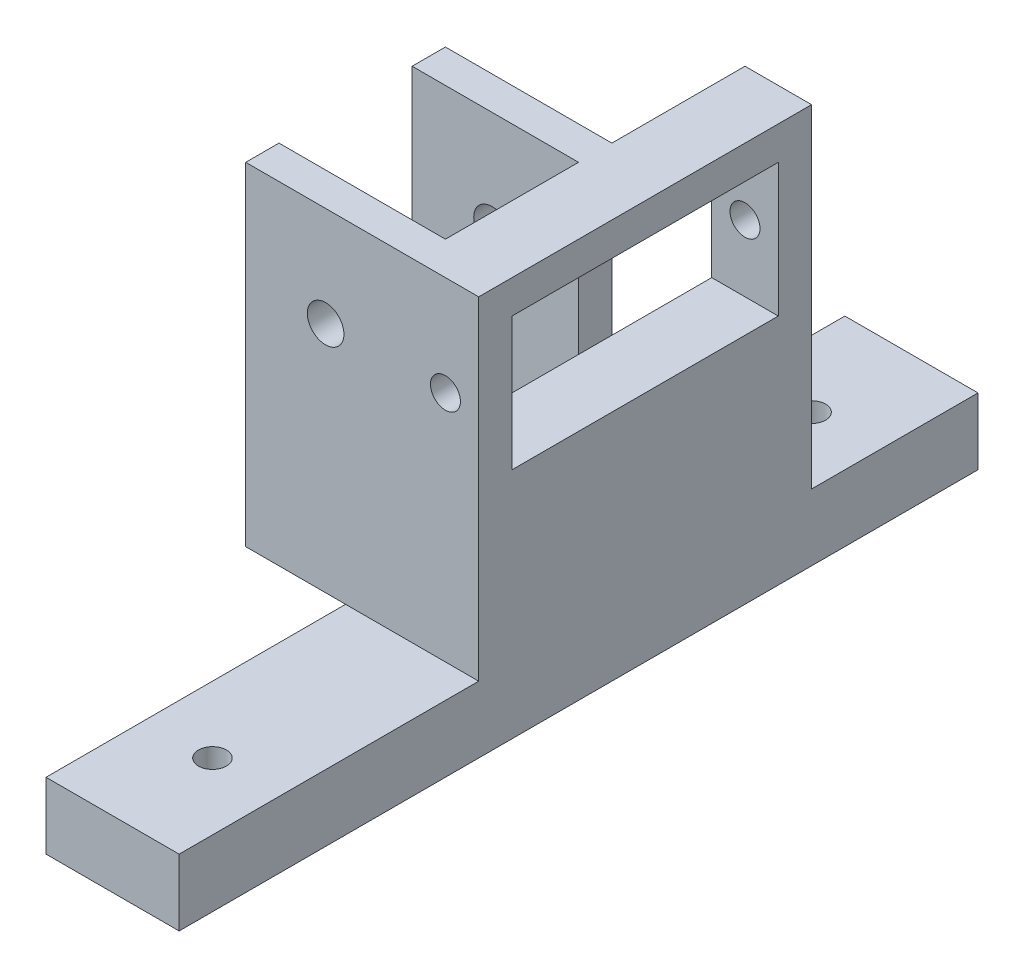
from build123d import *

# Parameters (mm, degrees)
SKETCH4_W            = 40
SKETCH4_H            = 80
BOSS_EXTRUDE4_DEPTH  = 5
SKETCH5_W            = 10
SKETCH5_H            = 5
BOSS_EXTRUDE6_DEPTH  = 50
SKETCH7_W            = 10
SKETCH7_H            = 25
SKETCH7_H_2          = 5
BOSS_EXTRUDE7_DEPTH  = 20
SKETCH9_W            = 80
SKETCH9_H            = 5
BOSS_EXTRUDE9_DEPTH  = 10
SKETCH10_W           = 50
SKETCH10_H           = 5
BOSS_EXTRUDE10_DEPTH = 20
SKETCH11_R           = 2.25
CUT_EXTRUDE1_DEPTH   = 25
SKETCH12_R           = 4
SKETCH12_R_2         = 2.25
CUT_EXTRUDE2_DEPTH   = 2
SKETCH15_W           = 5
SKETCH15_H           = 50
BOSS_EXTRUDE11_DEPTH = 20
CUT_EXTRUDE4_REACH   = 89.464
SKETCH16_R           = 2.75
SKETCH19_W           = 5
SKETCH19_H           = 50
BOSS_EXTRUDE12_DEPTH = 5
SKETCH21_W           = 50
SKETCH21_H           = 100
BOSS_EXTRUDE14_DEPTH = 5
SKETCH22_W           = 50
SKETCH22_H           = 10
BOSS_EXTRUDE15_DEPTH = 20
SKETCH24_W           = 35
SKETCH24_H           = 5
CUT_EXTRUDE5_DEPTH   = 50
SKETCH25_W           = 10
SKETCH25_H           = 25
SKETCH25_H_2         = 5
BOSS_EXTRUDE16_DEPTH = 25
SKETCH26_W           = 10
SKETCH26_H           = 5
BOSS_EXTRUDE17_DEPTH = 20
BOSS_EXTRUDE18_START = 2
SKETCH27_R           = 4
SKETCH27_R_2         = 2.25
BOSS_EXTRUDE18_DEPTH = 2
SKETCH28_R           = 2.25
CUT_EXTRUDE6_DEPTH   = 50
SKETCH29_W           = 25
SKETCH29_H           = 5
BOSS_EXTRUDE19_DEPTH = 50
SKETCH31_R           = 2.75
CUT_EXTRUDE7_DEPTH   = 30
SKETCH32_W           = 30
SKETCH32_H           = 45
CUT_EXTRUDE8_DEPTH   = 10
SKETCH33_W           = 30
SKETCH33_H           = 10
CUT_EXTRUDE9_DEPTH   = 30
SKETCH35_R           = 2.1
CUT_EXTRUDE10_DEPTH  = 10


with BuildPart() as part:
    # Sketch4 → Boss-Extrude4 (new body)
    with BuildSketch(Plane(origin=(0, 0, 0), x_dir=(1, 0, 0), z_dir=(0, 1, 0))):
        with Locations((20, 40)):
            Rectangle(SKETCH4_W, SKETCH4_H)
    extrude(amount=BOSS_EXTRUDE4_DEPTH)

    # Sketch5 → Boss-Extrude6 (add)
    with BuildSketch(Plane(origin=(0, 5, 0), x_dir=(1, 0, 0), z_dir=(0, 1, 0))):
        with Locations((35, 52.5)):
            Rectangle(SKETCH5_W, SKETCH5_H)
        with Locations((35, 27.5)):
            Rectangle(SKETCH5_W, SKETCH5_H)
    extrude(amount=BOSS_EXTRUDE6_DEPTH)

    # Sketch7 → Boss-Extrude7 (add)
    with BuildSketch(Plane.XY.offset(-50)):
        with Locations((35, 17.5)):
            Rectangle(SKETCH7_W, SKETCH7_H)
        with Locations((35, 52.5)):
            Rectangle(SKETCH7_W, SKETCH7_H_2)
    extrude(amount=BOSS_EXTRUDE7_DEPTH)

    # Sketch9 → Boss-Extrude9 (add)
    with BuildSketch(Plane.ZY):
        with Locations((-40, 2.5)):
            Rectangle(SKETCH9_W, SKETCH9_H)
    extrude(amount=BOSS_EXTRUDE9_DEPTH)

    # Sketch10 → Boss-Extrude10 (add)
    with BuildSketch(Plane.XY):
        with Locations((15, 2.5)):
            Rectangle(SKETCH10_W, SKETCH10_H)
    extrude(amount=BOSS_EXTRUDE10_DEPTH)

    # Sketch11 → Cut-Extrude1 (cut, symmetric)
    with BuildSketch(Plane.XY.offset(-50)):
        with Locations((35, 40)):
            Circle(SKETCH11_R)
    extrude(amount=CUT_EXTRUDE1_DEPTH, both=True, mode=Mode.SUBTRACT)

    # Sketch12 → Cut-Extrude2 (cut)
    with BuildSketch(Plane.XY.offset(-25)):
        with Locations((35, 40)):
            Circle(SKETCH12_R)
        with Locations((35, 40)):
            Circle(SKETCH12_R_2, mode=Mode.SUBTRACT)
    extrude(amount=-CUT_EXTRUDE2_DEPTH, mode=Mode.SUBTRACT)

    # Sketch15 → Boss-Extrude11 (add)
    with BuildSketch(Plane.ZY.offset(-30)):
        with Locations((-52.5, 30)):
            Rectangle(SKETCH15_W, SKETCH15_H)
        with Locations((-27.5, 30)):
            Rectangle(SKETCH15_W, SKETCH15_H)
    extrude(amount=BOSS_EXTRUDE11_DEPTH)

    # Cut-Extrude4: up to this face of the body (flat: up to its plane)
    cut_extrude4_end = Plane(part.part.faces().sort_by_distance((24.892834991, 29.892834991, -55))[0])
    # Sketch16 → Cut-Extrude4 (cut, up to the picked face)
    with BuildSketch(Plane.XY.offset(-25), mode=Mode.PRIVATE) as cut_extrude4_sk1:
        with Locations((17, 40)):
            Circle(SKETCH16_R)
    cut_extrude4_tool1 = split(extrude(cut_extrude4_sk1.sketch, amount=-CUT_EXTRUDE4_REACH, mode=Mode.PRIVATE), bisect_by=cut_extrude4_end, keep=Keep.BOTH, mode=Mode.PRIVATE)
    add(cut_extrude4_tool1.solids().sort_by(Axis((17, 40, -25), (0, 0, -1)))[0], mode=Mode.SUBTRACT)

    # Sketch19 → Boss-Extrude12 (add)
    with BuildSketch(Plane.ZY.offset(-10)):
        with Locations((-52.5, 30)):
            Rectangle(SKETCH19_W, SKETCH19_H)
        with Locations((-27.5, 30)):
            Rectangle(SKETCH19_W, SKETCH19_H)
    extrude(amount=BOSS_EXTRUDE12_DEPTH)

    # Sketch21 → Boss-Extrude14 (add)
    with BuildSketch(Plane.XZ):
        with Locations((15, -30)):
            Rectangle(SKETCH21_W, SKETCH21_H)
    extrude(amount=BOSS_EXTRUDE14_DEPTH)

    # Sketch22 → Boss-Extrude15 (add)
    with BuildSketch(Plane(origin=(0, 0, -80), x_dir=(-1, 0, 0), z_dir=(0, 0, -1))):
        with Locations((-15, 0)):
            Rectangle(SKETCH22_W, SKETCH22_H)
    extrude(amount=BOSS_EXTRUDE15_DEPTH)

    # Sketch24 → Cut-Extrude5 (cut)
    with BuildSketch(Plane(origin=(0, 55, 0), x_dir=(1, 0, 0), z_dir=(0, 1, 0))):
        with Locations((22.5, 52.5)):
            Rectangle(SKETCH24_W, SKETCH24_H)
    extrude(amount=-CUT_EXTRUDE5_DEPTH, mode=Mode.SUBTRACT)

    # Sketch25 → Boss-Extrude16 (add)
    with BuildSketch(Plane(origin=(0, 0, -50), x_dir=(-1, 0, 0), z_dir=(0, 0, -1))):
        with Locations((-35, 17.5)):
            Rectangle(SKETCH25_W, SKETCH25_H)
        with Locations((-35, 52.5)):
            Rectangle(SKETCH25_W, SKETCH25_H_2)
    extrude(amount=BOSS_EXTRUDE16_DEPTH)

    # Sketch26 → Boss-Extrude17 (add)
    with BuildSketch(Plane(origin=(0, 30, 0), x_dir=(1, 0, 0), z_dir=(0, 1, 0))):
        with Locations((35, 72.5)):
            Rectangle(SKETCH26_W, SKETCH26_H)
    extrude(amount=BOSS_EXTRUDE17_DEPTH)

    # Sketch27 → Boss-Extrude18 (add)
    with BuildSketch(Plane.XY.offset(-27).offset(BOSS_EXTRUDE18_START)):
        with Locations((35, 40)):
            Circle(SKETCH27_R)
        with Locations((35, 40)):
            Circle(SKETCH27_R_2, mode=Mode.SUBTRACT)
    extrude(amount=-BOSS_EXTRUDE18_DEPTH)

    # Sketch28 → Cut-Extrude6 (cut)
    with BuildSketch(Plane.XY.offset(-25)):
        with Locations((35, 40)):
            Circle(SKETCH28_R)
    extrude(amount=-CUT_EXTRUDE6_DEPTH, mode=Mode.SUBTRACT)

    # Sketch29 → Boss-Extrude19 (add)
    with BuildSketch(Plane(origin=(0, 5, 0), x_dir=(1, 0, 0), z_dir=(0, 1, 0))):
        with Locations((17.5, 52.5)):
            Rectangle(SKETCH29_W, SKETCH29_H)
    extrude(amount=BOSS_EXTRUDE19_DEPTH)

    # Sketch31 → Cut-Extrude7 (cut)
    with BuildSketch(Plane.XY.offset(-25)):
        with Locations((17, 40)):
            Circle(SKETCH31_R)
    extrude(amount=-CUT_EXTRUDE7_DEPTH, mode=Mode.SUBTRACT)

    # Sketch32 → Cut-Extrude8 (cut)
    with BuildSketch(Plane(origin=(0, 5, 0), x_dir=(1, 0, 0), z_dir=(0, 1, 0))):
        with Locations((5, 77.5)):
            Rectangle(SKETCH32_W, SKETCH32_H)
        with Locations((5, 2.5)):
            Rectangle(SKETCH32_W, SKETCH32_H)
    extrude(amount=-CUT_EXTRUDE8_DEPTH, mode=Mode.SUBTRACT)

    # Sketch33 → Cut-Extrude9 (cut)
    with BuildSketch(Plane.ZY.offset(10)):
        with Locations((-40, 0)):
            Rectangle(SKETCH33_W, SKETCH33_H)
    extrude(amount=-CUT_EXTRUDE9_DEPTH, mode=Mode.SUBTRACT)

    # Sketch35 → Cut-Extrude10 (cut)
    with BuildSketch(Plane(origin=(0, 5, 0), x_dir=(1, 0, 0), z_dir=(0, 1, 0))):
        with Locations(Location((30, 85, 0), (0, 0, 270))):
            Circle(SKETCH35_R)
        with Locations(Location((30, -5, 0), (0, 0, 270))):
            Circle(SKETCH35_R)
    extrude(amount=-CUT_EXTRUDE10_DEPTH, mode=Mode.SUBTRACT)


solid = part.part
